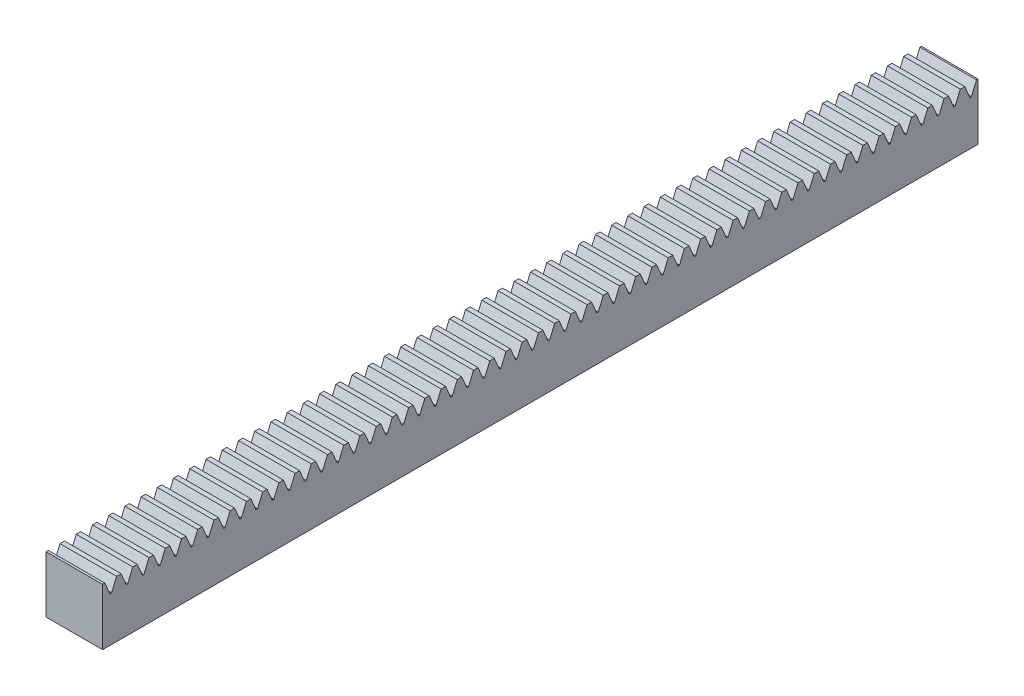
from build123d import *

# Parameters (mm, degrees)
SKETCH1_W              = 19.05
SKETCH1_H              = 19.05
BOSS_EXTRUDE1_DEPTH    = 294.64
CUT_EXTRUDE2_DEPTH     = 157.48
FILLET2_R              = 0.127
FILLET3_R              = 0.127
LPATTERN6_COUNT        = 54
LPATTERN6_PITCH        = 5.461
FILLET2_OF_LPATTERN6_R = 0.127
FILLET3_OF_LPATTERN6_R = 0.127


with BuildPart() as part:
    # Sketch1 → Boss-Extrude1 (new body)
    with BuildSketch(Plane.XY):
        Rectangle(SKETCH1_W, SKETCH1_H)
    extrude(amount=BOSS_EXTRUDE1_DEPTH)

    # Sketch3 → Cut-Extrude2 (cut)
    with BuildSketch(Plane(origin=(9.525, 0, 0), x_dir=(0, 0, -1), z_dir=(1, 0, 0))):
        Polygon((-293.878, 9.525), (-289.941, 9.525), (-291.6555, 5.461), (-292.1635, 5.461), align=None)
    cut_extrude2 = extrude(amount=-CUT_EXTRUDE2_DEPTH, mode=Mode.SUBTRACT)

    # Fillet2
    fillet2_edges = [part.edges().sort_by_distance(p)[0] for p in [
        (0, 5.461, 292.1635),
    ]]
    fillet(fillet2_edges, radius=FILLET2_R)

    # Fillet3
    fillet3_edges = [part.edges().sort_by_distance(p)[0] for p in [
        (0, 5.461, 291.6555),
    ]]
    fillet(fillet3_edges, radius=FILLET3_R)

    # LPattern6: Cut-Extrude2 ×54
    with Locations(*[(0, 0, -i * LPATTERN6_PITCH) for i in range(1, LPATTERN6_COUNT)]):
        add(cut_extrude2, mode=Mode.SUBTRACT)

    # Fillet2 of LPattern6
    fillet2_of_lpattern6_edges = [part.edges().sort_by_distance(p)[0] for p in [
        (0, 5.461, 286.7025),
        (0, 5.461, 281.2415),
        (0, 5.461, 275.7805),
        (0, 5.461, 270.3195),
        (0, 5.461, 264.8585),
        (0, 5.461, 259.3975),
        (0, 5.461, 253.9365),
        (0, 5.461, 248.4755),
        (0, 5.461, 243.0145),
        (0, 5.461, 237.5535),
        (0, 5.461, 232.0925),
        (0, 5.461, 226.6315),
        (0, 5.461, 221.1705),
        (0, 5.461, 215.7095),
        (0, 5.461, 210.2485),
        (0, 5.461, 204.7875),
        (0, 5.461, 199.3265),
        (0, 5.461, 193.8655),
        (0, 5.461, 188.4045),
        (0, 5.461, 182.9435),
        (0, 5.461, 177.4825),
        (0, 5.461, 172.0215),
        (0, 5.461, 166.5605),
        (0, 5.461, 161.0995),
        (0, 5.461, 155.6385),
        (0, 5.461, 150.1775),
        (0, 5.461, 144.7165),
        (0, 5.461, 139.2555),
        (0, 5.461, 133.7945),
        (0, 5.461, 128.3335),
        (0, 5.461, 122.8725),
        (0, 5.461, 117.4115),
        (0, 5.461, 111.9505),
        (0, 5.461, 106.4895),
        (0, 5.461, 101.0285),
        (0, 5.461, 95.5675),
        (0, 5.461, 90.1065),
        (0, 5.461, 84.6455),
        (0, 5.461, 79.1845),
        (0, 5.461, 73.7235),
        (0, 5.461, 68.2625),
        (0, 5.461, 62.8015),
        (0, 5.461, 57.3405),
        (0, 5.461, 51.8795),
        (0, 5.461, 46.4185),
        (0, 5.461, 40.9575),
        (0, 5.461, 35.4965),
        (0, 5.461, 30.0355),
        (0, 5.461, 24.5745),
        (0, 5.461, 19.1135),
        (0, 5.461, 13.6525),
        (0, 5.461, 8.1915),
        (0, 5.461, 2.7305),
    ]]
    fillet(fillet2_of_lpattern6_edges, radius=FILLET2_OF_LPATTERN6_R)

    # Fillet3 of LPattern6
    fillet3_of_lpattern6_edges = [part.edges().sort_by_distance(p)[0] for p in [
        (0, 5.461, 286.1945),
        (0, 5.461, 280.7335),
        (0, 5.461, 275.2725),
        (0, 5.461, 269.8115),
        (0, 5.461, 264.3505),
        (0, 5.461, 258.8895),
        (0, 5.461, 253.4285),
        (0, 5.461, 247.9675),
        (0, 5.461, 242.5065),
        (0, 5.461, 237.0455),
        (0, 5.461, 231.5845),
        (0, 5.461, 226.1235),
        (0, 5.461, 220.6625),
        (0, 5.461, 215.2015),
        (0, 5.461, 209.7405),
        (0, 5.461, 204.2795),
        (0, 5.461, 198.8185),
        (0, 5.461, 193.3575),
        (0, 5.461, 187.8965),
        (0, 5.461, 182.4355),
        (0, 5.461, 176.9745),
        (0, 5.461, 171.5135),
        (0, 5.461, 166.0525),
        (0, 5.461, 160.5915),
        (0, 5.461, 155.1305),
        (0, 5.461, 149.6695),
        (0, 5.461, 144.2085),
        (0, 5.461, 138.7475),
        (0, 5.461, 133.2865),
        (0, 5.461, 127.8255),
        (0, 5.461, 122.3645),
        (0, 5.461, 116.9035),
        (0, 5.461, 111.4425),
        (0, 5.461, 105.9815),
        (0, 5.461, 100.5205),
        (0, 5.461, 95.0595),
        (0, 5.461, 89.5985),
        (0, 5.461, 84.1375),
        (0, 5.461, 78.6765),
        (0, 5.461, 73.2155),
        (0, 5.461, 67.7545),
        (0, 5.461, 62.2935),
        (0, 5.461, 56.8325),
        (0, 5.461, 51.3715),
        (0, 5.461, 45.9105),
        (0, 5.461, 40.4495),
        (0, 5.461, 34.9885),
        (0, 5.461, 29.5275),
        (0, 5.461, 24.0665),
        (0, 5.461, 18.6055),
        (0, 5.461, 13.1445),
        (0, 5.461, 7.6835),
        (0, 5.461, 2.2225),
    ]]
    fillet(fillet3_of_lpattern6_edges, radius=FILLET3_OF_LPATTERN6_R)


solid = part.part
